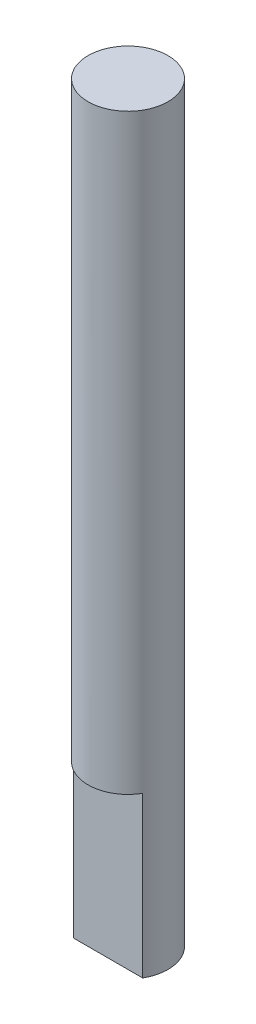
from build123d import *

# Parameters (mm, degrees)
SZKIC1_R                    = 5
DODANIE_WYCI_GNI_CIE1_DEPTH = 94
SZKIC2_W                    = 10.9625046
SZKIC2_H                    = 5
WYTNIJ_WYCI_GNI_CIE1_DEPTH  = 20


with BuildPart() as part:
    # Szkic1 → Dodanie-wyciągnięcie1 (new body)
    with BuildSketch(Plane(origin=(0, 0, 0), x_dir=(1, 0, 0), z_dir=(0, 1, 0))):
        with Locations(Location((0, 0, 0), (0, 0, 270))):
            Circle(SZKIC1_R)
    extrude(amount=DODANIE_WYCI_GNI_CIE1_DEPTH)

    # Szkic2 → Wytnij-wyciągnięcie1 (cut)
    with BuildSketch(Plane.XZ):
        with Locations((0, 5)):
            Rectangle(SZKIC2_W, SZKIC2_H)
    extrude(amount=-WYTNIJ_WYCI_GNI_CIE1_DEPTH, mode=Mode.SUBTRACT)


solid = part.part
